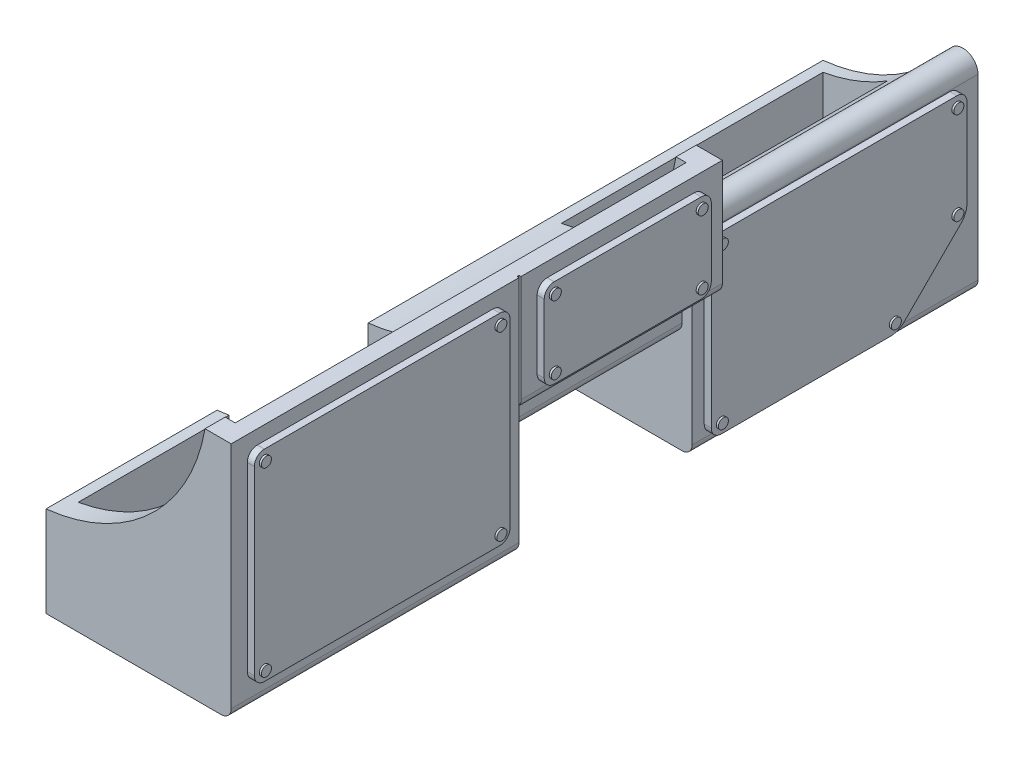
from build123d import *
from OCP.BRepFilletAPI import BRepFilletAPI_MakeFillet

# Parameters (mm, degrees)
BOSS_EXTRUDE1_DEPTH = 38.6
SKETCH4_W           = 12.7
SKETCH4_H           = 10
SKETCH4_W_2         = 8.3
SKETCH4_H_2         = 4.4
BOSS_EXTRUDE2_DEPTH = 0.35
FILLET1_R           = 0.5
SKETCH5_R           = 0.25
BOSS_EXTRUDE3_DEPTH = 0.1
CUT_EXTRUDE1_DEPTH  = 2
BOSS_EXTRUDE9_DEPTH = 14.2
CUT_EXTRUDE4_DEPTH  = 31.569586755
SKETCH7_W           = 10.1
SKETCH7_H           = 3.4
CUT_EXTRUDE2_DEPTH  = 43.050481162
BOSS_EXTRUDE5_DEPTH = 0.35
FILLET2_R1          = 0.5
FILLET2_R2          = 1
SKETCH9_R           = 0.25
BOSS_EXTRUDE6_DEPTH = 0.1
FILLET4_R           = 0.5
SKETCH16_W          = 0.1
SKETCH16_H          = 5.8
CUT_EXTRUDE6_DEPTH  = 0.1
SKETCH13_W          = 5.5
SKETCH13_H          = 7.5
CUT_EXTRUDE5_DEPTH  = 43.767974401
SKETCH14_W          = 0.5
SKETCH14_H          = 12.7
CUT_EXTRUDE7_DEPTH  = 11.3
SKETCH14_3_W        = 2.4
SKETCH14_3_H        = 9.7
SKETCH14_3_W_2      = 0.5
CUT_EXTRUDE8_DEPTH  = 5.3
CUT_EXTRUDE9_DEPTH  = 7.4
CUT_EXTRUDE10_START = -0.6
CUT_EXTRUDE10_DEPTH = 13


with BuildPart() as part:
    # Sketch2 → Boss-Extrude1 (new body)
    with BuildSketch(Plane.XY):
        with BuildLine():
            Line((0.965868705, -13.448021996), (0.965868705, -8.948021996))
            ThreePointArc((0.965868705, -8.948021996), (6.152703888, -6.568427123), (8.865868705, -1.548021996))
            Line((8.865868705, -1.548021996), (10.165868705, -1.548021996))
            Line((10.165868705, -1.548021996), (10.165868705, -13.448021996))
            Line((10.165868705, -13.448021996), (0.965868705, -13.448021996))
        make_face()
    extrude(amount=-BOSS_EXTRUDE1_DEPTH)

    # Sketch4 → Boss-Extrude2 (add)
    with BuildSketch(Plane(origin=(10.165868705, 0, 0), x_dir=(0, 0, -1), z_dir=(1, 0, 0))):
        with Locations((7.15, -7.248021996)):
            Rectangle(SKETCH4_W, SKETCH4_H)
        with Locations((19.35, -4.448021996)):
            Rectangle(SKETCH4_W_2, SKETCH4_H_2)
    extrude(amount=BOSS_EXTRUDE2_DEPTH)

    # Fillet1
    fillet1_edges = [part.edges().sort_by_distance(p)[0] for p in [
        (10.340868705, -2.248021996, -0.8),
        (10.340868705, -12.248021996, -0.8),
        (10.340868705, -12.248021996, -13.5),
        (10.340868705, -2.248021996, -13.5),
        (10.340868705, -2.248021996, -15.2),
        (10.340868705, -6.648021996, -15.2),
        (10.340868705, -6.648021996, -23.5),
        (10.340868705, -2.248021996, -23.5),
    ]]
    fillet(fillet1_edges, radius=FILLET1_R)

    # Sketch5 → Boss-Extrude3 (add)
    with BuildSketch(Plane(origin=(10.515868705, 0, 0), x_dir=(0, 0, -1), z_dir=(1, 0, 0))):
        with Locations(Location((1.3, -2.748021996, 0), (0, 0, 180))):
            Circle(SKETCH5_R)
        with Locations(Location((13, -2.748021996, 0), (0, 0, 180))):
            Circle(SKETCH5_R)
        with Locations((15.7, -2.748021996)):
            Circle(SKETCH5_R)
        with Locations((15.7, -6.148021996)):
            Circle(SKETCH5_R)
        with Locations(Location((13, -11.748021996, 0), (0, 0, 180))):
            Circle(SKETCH5_R)
        with Locations(Location((1.3, -11.748021996, 0), (0, 0, 180))):
            Circle(SKETCH5_R)
        with Locations((23, -2.748021996)):
            Circle(SKETCH5_R)
        with Locations((23, -6.148021996)):
            Circle(SKETCH5_R)
    extrude(amount=BOSS_EXTRUDE3_DEPTH)

    # Sketch3 → Cut-Extrude1 (cut)
    with BuildSketch(Plane(origin=(10.165868705, 0, 0), x_dir=(0, 0, -1), z_dir=(1, 0, 0))):
        Polygon((14.3, -13.448021996), (14.3, -7.348021996), (24.4, -7.348021996), (24.4, -1.548021996), (38.6, -1.548021996), (38.6, -13.448021996), align=None)
    extrude(amount=-CUT_EXTRUDE1_DEPTH, mode=Mode.SUBTRACT)

    # Sketch12 → Boss-Extrude9 (add)
    with BuildSketch(Plane(origin=(0, 0, -24.4), x_dir=(-1, 0, 0), z_dir=(0, 0, -1))):
        with BuildLine():
            Line((-8.165868705, -7.348021996), (-8.665868705, -7.348021996))
            Line((-8.665868705, -7.348021996), (-8.665868705, -15.048021996))
            Line((-8.665868705, -15.048021996), (-0.965868705, -15.048021996))
            Line((-0.965868705, -15.048021996), (-0.965868705, -8.948021996))
            ThreePointArc((-0.965868705, -8.948021996), (-4.526567846, -7.778829188), (-7.302349494, -5.260769133))
            ThreePointArc((-7.302349494, -5.260769133), (-7.689196636, -4.98209684), (-8.165868705, -4.991724772))
            Line((-8.165868705, -4.991724772), (-8.165868705, -7.348021996))
        make_face()
        with BuildLine():
            ThreePointArc((-8.165868705, -4.991724772), (-8.528297691, -5.266969628), (-8.665868705, -5.700776862))
            Line((-8.665868705, -5.700776862), (-8.665868705, -7.348021996))
            Line((-8.665868705, -7.348021996), (-8.165868705, -7.348021996))
            Line((-8.165868705, -7.348021996), (-8.165868705, -4.991724772))
        make_face()
    extrude(amount=BOSS_EXTRUDE9_DEPTH)

    # Sketch12<3> → Cut-Extrude4 (cut, through all)
    with BuildSketch(Plane(origin=(0, 0, -24.4), x_dir=(-1, 0, 0), z_dir=(0, 0, -1))):
        with BuildLine():
            Line((-8.165868705, -3.783991053), (-8.165868705, -4.991724772))
            ThreePointArc((-8.165868705, -4.991724772), (-7.689196636, -4.98209684), (-7.302349494, -5.260769133))
            ThreePointArc((-7.302349494, -5.260769133), (-7.769276796, -4.542943766), (-8.165868705, -3.783991053))
        make_face()
        with BuildLine():
            Line((-8.665868705, -2.429551313), (-8.665868705, -5.700776862))
            ThreePointArc((-8.665868705, -5.700776862), (-8.528297691, -5.266969628), (-8.165868705, -4.991724772))
            Line((-8.165868705, -4.991724772), (-8.165868705, -3.783991053))
            ThreePointArc((-8.165868705, -3.783991053), (-8.443072475, -3.116813627), (-8.665868705, -2.429551313))
        make_face()
    extrude(amount=CUT_EXTRUDE4_DEPTH, mode=Mode.SUBTRACT)

    # Sketch7 → Cut-Extrude2 (cut, through all)
    with BuildSketch(Plane(origin=(8.165868705, 0, 0), x_dir=(0, 0, -1), z_dir=(1, 0, 0))):
        with Locations((19.35, -11.748021996)):
            Rectangle(SKETCH7_W, SKETCH7_H)
    extrude(amount=-CUT_EXTRUDE2_DEPTH, mode=Mode.SUBTRACT)

    # Sketch8 → Boss-Extrude5 (add)
    with BuildSketch(Plane(origin=(8.665868705, 0, 0), x_dir=(0, 0, -1), z_dir=(1, 0, 0))):
        Polygon((25, -14.448021996), (25, -5.748021996), (37.7, -5.748021996), (37.7, -11.048021996), (34.3, -14.448021996), align=None)
    extrude(amount=BOSS_EXTRUDE5_DEPTH)

    # Fillet2: one fillet with a radius per group of edges: ONE call of the kernel's fillet builder (fillet() takes one radius for all edges)
    fillet2_edges_1 = [part.edges().sort_by_distance(p)[0] for p in [
        (8.840868705, -5.748021996, -25),
        (8.840868705, -14.448021996, -25),
        (8.840868705, -5.748021996, -37.7),
    ]]
    fillet2_edges_2 = [part.edges().sort_by_distance(p)[0] for p in [
        (8.840868705, -14.448021996, -34.3),
        (8.840868705, -11.048021996, -37.7),
    ]]
    fillet2 = BRepFilletAPI_MakeFillet(part.part.solid().wrapped)
    for e in fillet2_edges_1:
        fillet2.Add(FILLET2_R1, e.wrapped)
    for e in fillet2_edges_2:
        fillet2.Add(FILLET2_R2, e.wrapped)
    add(Compound.cast(fillet2.Shape()), mode=Mode.REPLACE)

    # Sketch9 → Boss-Extrude6 (add)
    with BuildSketch(Plane(origin=(9.015868705, 0, 0), x_dir=(0, 0, -1), z_dir=(1, 0, 0))):
        with Locations(Location((25.5, -6.248021996, 0), (0, 0, 180))):
            Circle(SKETCH9_R)
        with Locations(Location((25.5, -13.948021996, 0), (0, 0, 180))):
            Circle(SKETCH9_R)
        with Locations(Location((37.2, -6.248021996, 0), (0, 0, 180))):
            Circle(SKETCH9_R)
        with Locations(Location((34.092893219, -13.948021996, 0), (0, 0, 180))):
            Circle(SKETCH9_R)
        with Locations(Location((37.2, -10.840915215, 0), (0, 0, 180))):
            Circle(SKETCH9_R)
    extrude(amount=BOSS_EXTRUDE6_DEPTH)

    # Fillet4
    fillet4_edges = [part.edges().sort_by_distance(p)[0] for p in [
        (10.165868705, -13.448021996, -7.15),
        (10.165868705, -7.348021996, -19.35),
        (8.665868705, -15.048021996, -31.5),
        (8.165868705, -10.048021996, -19.35),
    ]]
    fillet(fillet4_edges, radius=FILLET4_R)

    # Sketch16 → Cut-Extrude6 (cut)
    with BuildSketch(Plane(origin=(10.165868705, 0, 0), x_dir=(0, 0, -1), z_dir=(1, 0, 0))):
        with Locations((14.35, -4.448021996)):
            Rectangle(SKETCH16_W, SKETCH16_H)
    extrude(amount=-CUT_EXTRUDE6_DEPTH, mode=Mode.SUBTRACT)

    # Sketch13 → Cut-Extrude5 (cut, through all)
    with BuildSketch(Plane(origin=(0, 0, 0), x_dir=(1, 0, 0), z_dir=(0, 1, 0))):
        with Locations((3.715868705, 12.25)):
            Rectangle(SKETCH13_W, SKETCH13_H)
    extrude(amount=-CUT_EXTRUDE5_DEPTH, mode=Mode.SUBTRACT)

    # Sketch14 → Cut-Extrude7 (cut)
    with BuildSketch(Plane(origin=(0, -1.548021996, 0), x_dir=(1, 0, 0), z_dir=(0, 1, 0))):
        Polygon((1.565868705, 1), (8.865868705, 1), (8.865868705, 13.7), (6.465868705, 13.7), (1.565868705, 13.7), align=None)
        with Locations((9.115868705, 7.35)):
            Rectangle(SKETCH14_W, SKETCH14_H)
    extrude(amount=-CUT_EXTRUDE7_DEPTH, mode=Mode.SUBTRACT)

    # Sketch14<3> → Cut-Extrude8 (cut)
    with BuildSketch(Plane(origin=(0, -1.548021996, 0), x_dir=(1, 0, 0), z_dir=(0, 1, 0))):
        with Locations((7.665868705, 18.55)):
            Rectangle(SKETCH14_3_W, SKETCH14_3_H)
        with Locations((9.115868705, 18.55)):
            Rectangle(SKETCH14_3_W_2, SKETCH14_3_H)
    extrude(amount=-CUT_EXTRUDE8_DEPTH, mode=Mode.SUBTRACT)

    # Sketch17 → Cut-Extrude9 (cut)
    with BuildSketch(Plane.XY.offset(-16)):
        with BuildLine():
            Line((6.465868705, -6.260394707), (6.465868705, -6.848021996))
            Line((6.465868705, -6.848021996), (5.839913933, -6.848021996))
            ThreePointArc((5.839913933, -6.848021996), (6.159902438, -6.561676764), (6.465868705, -6.260394707))
        make_face()
    extrude(amount=-CUT_EXTRUDE9_DEPTH, mode=Mode.SUBTRACT)

    # Sketch18 → Cut-Extrude10 (cut)
    with BuildSketch(Plane(origin=(0, 0, -38.6), x_dir=(-1, 0, 0), z_dir=(0, 0, -1)).offset(CUT_EXTRUDE10_START)):
        Polygon((-8.065868705, -14.448021996), (-8.065868705, -7.634559286), (-4.765868705, -7.634559286), (-4.765868705, -1.548021996), (-1.565868705, -1.548021996), (-1.565868705, -14.448021996), align=None)
    extrude(amount=-CUT_EXTRUDE10_DEPTH, mode=Mode.SUBTRACT)


solid = part.part
